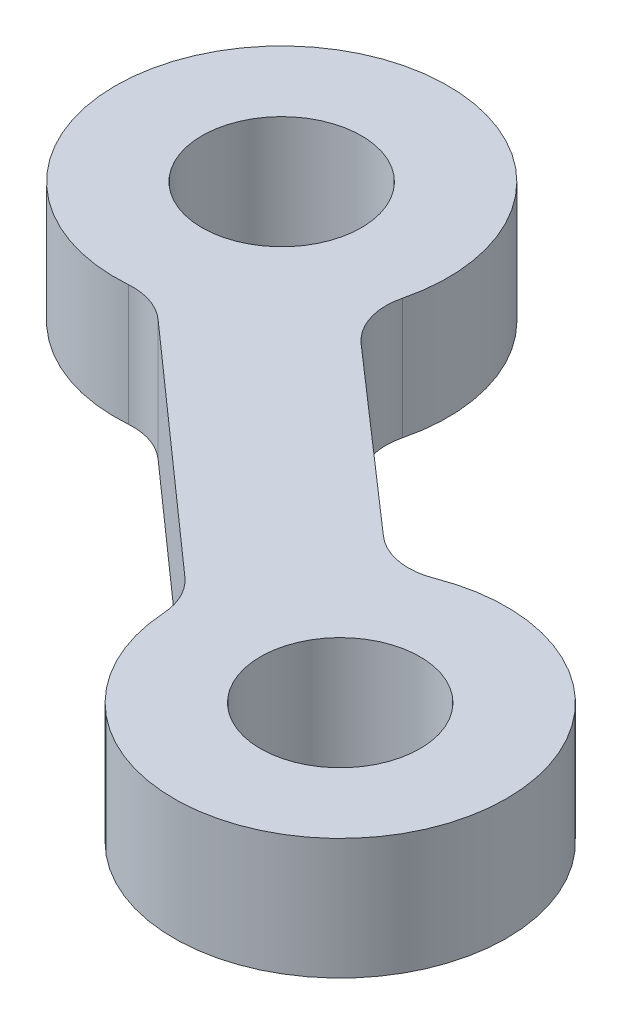
from build123d import *

# Parameters (mm, degrees)
SKETCH1_R           = 2.6375
BOSS_EXTRUDE1_DEPTH = 4


with BuildPart() as part:
    # Sketch1 → Boss-Extrude1 (new body)
    with BuildSketch(Plane.XZ):
        with BuildLine():
            Line((91.828846411, -34.604196587), (83.987808778, -41.556583288))
            ThreePointArc((83.987808778, -41.556583288), (83.299503374, -41.95543418), (82.510169812, -42.054423534))
            ThreePointArc((82.510169812, -42.054423534), (78.551510946, -51.744694217), (87.430169632, -46.200170264))
            ThreePointArc((87.430169632, -46.200170264), (87.461256355, -45.116261185), (88.053439291, -44.207886459))
            Line((88.053439291, -44.207886459), (93.937481824, -39.062233577))
            ThreePointArc((93.937481824, -39.062233577), (94.910198817, -38.597536781), (95.982821704, -38.705247518))
            ThreePointArc((95.982821704, -38.705247518), (102.625664422, -30.628415987), (92.497951624, -33.234562654))
            ThreePointArc((92.497951624, -33.234562654), (92.299001629, -33.985625361), (91.828846411, -34.604196587))
        make_face()
        with Locations(Location((82.095552315, -47.538773298, 0), (0, 0, 90))):
            Circle(SKETCH1_R, mode=Mode.SUBTRACT)
        with Locations(Location((97.986880619, -33.583358427, 0), (0, 0, 90))):
            Circle(SKETCH1_R, mode=Mode.SUBTRACT)
    extrude(amount=-BOSS_EXTRUDE1_DEPTH)


solid = part.part
